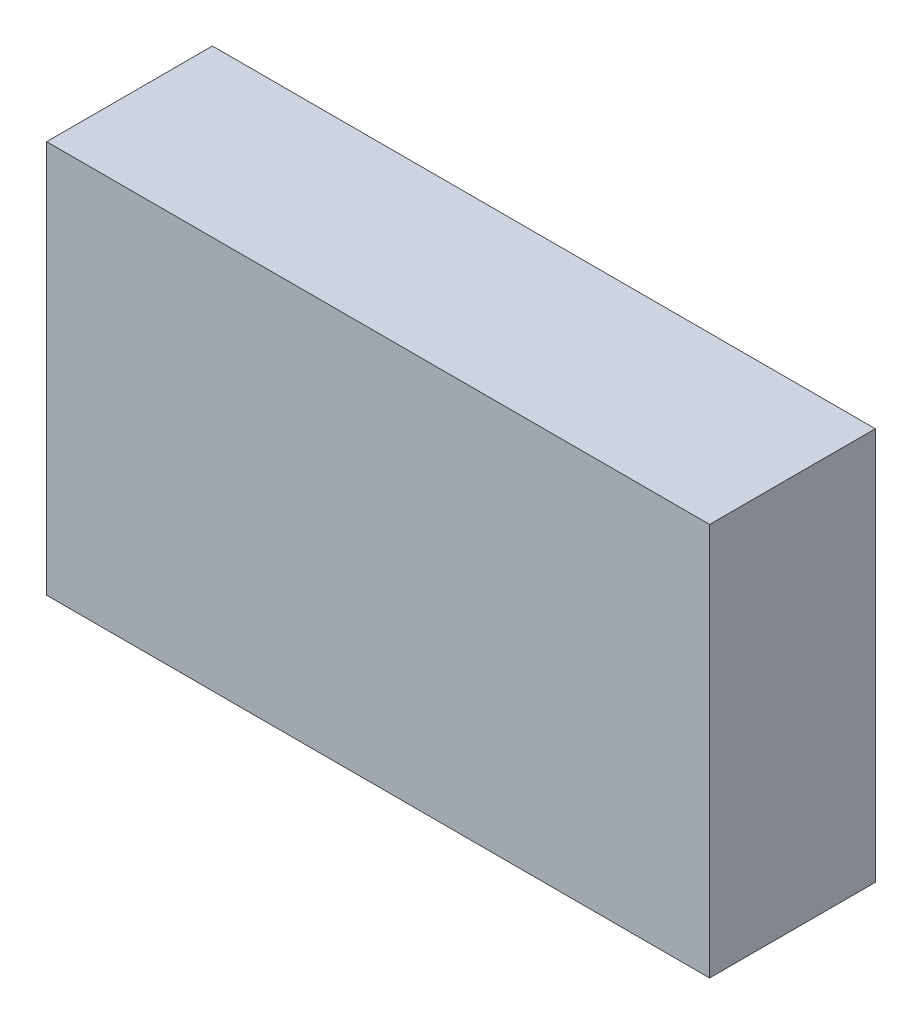
from build123d import *

# Parameters (mm, degrees)
SKETCH1_W           = 40
SKETCH1_H           = 23.7
BOSS_EXTRUDE1_DEPTH = 10


with BuildPart() as part:
    # Sketch1 → Boss-Extrude1 (new body)
    with BuildSketch(Plane.XY):
        with Locations((20, 11.85)):
            Rectangle(SKETCH1_W, SKETCH1_H)
    extrude(amount=BOSS_EXTRUDE1_DEPTH)


solid = part.part
